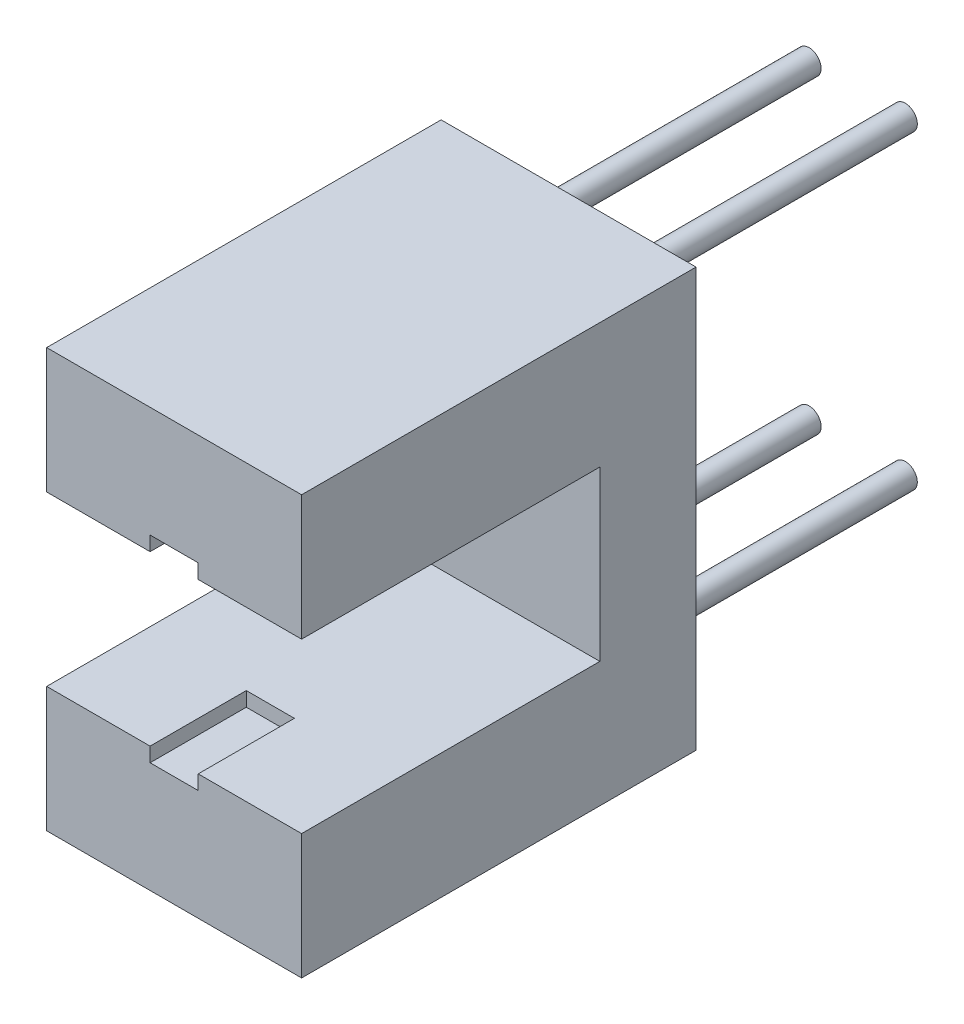
from build123d import *

# Parameters (mm, degrees)
SKETCH1_W             = 5.3
SKETCH1_H             = 2.6
BOSS_EXTRUDE1_DEPTH   = 6.2
BOSS_EXTRUDE1_2_DEPTH = 6.2
SKETCH2_W             = 5.3
SKETCH2_H             = 8.7
BOSS_EXTRUDE2_DEPTH   = 2
SKETCH3_W             = 1
SKETCH3_H             = 4.1
CUT_EXTRUDE1_DEPTH    = 2
SKETCH4_R             = 0.25
BOSS_EXTRUDE3_DEPTH   = 6


with BuildPart() as part:
    # Sketch1 → Boss-Extrude1 (new body)
    with BuildSketch(Plane.XY):
        with Locations((0, 3.05)):
            Rectangle(SKETCH1_W, SKETCH1_H)
    extrude(amount=BOSS_EXTRUDE1_DEPTH)



with BuildPart() as body_2:
    # Sketch1 → Boss-Extrude1 2 (new body)
    with BuildSketch(Plane.XY):
        with Locations((0, -3.05)):
            Rectangle(SKETCH1_W, SKETCH1_H)
    extrude(amount=BOSS_EXTRUDE1_2_DEPTH)


with BuildPart() as part_1:
    add(part.part)

    add(body_2.part)  # Boss-Extrude2 merges body 2
    # Sketch2 → Boss-Extrude2 (add)
    with BuildSketch(Plane(origin=(0, 0, 0), x_dir=(-1, 0, 0), z_dir=(0, 0, -1))):
        Rectangle(SKETCH2_W, SKETCH2_H)
    extrude(amount=BOSS_EXTRUDE2_DEPTH)

    # Sketch3 → Cut-Extrude1 (cut)
    with BuildSketch(Plane.XY.offset(6.2)):
        Rectangle(SKETCH3_W, SKETCH3_H)
    extrude(amount=-CUT_EXTRUDE1_DEPTH, mode=Mode.SUBTRACT)

    # Sketch4 → Boss-Extrude3 (add)
    with BuildSketch(Plane(origin=(0, 0, -2), x_dir=(-1, 0, 0), z_dir=(0, 0, -1))):
        with Locations((-1, -3.225)):
            Circle(SKETCH4_R)
        with Locations(Location((1, -3.225, 0), (0, 0, 180))):
            Circle(SKETCH4_R)
        with Locations((1, 3.225)):
            Circle(SKETCH4_R)
        with Locations(Location((-1, 3.225, 0), (0, 0, 180))):
            Circle(SKETCH4_R)
    extrude(amount=BOSS_EXTRUDE3_DEPTH)


solid = part_1.part
